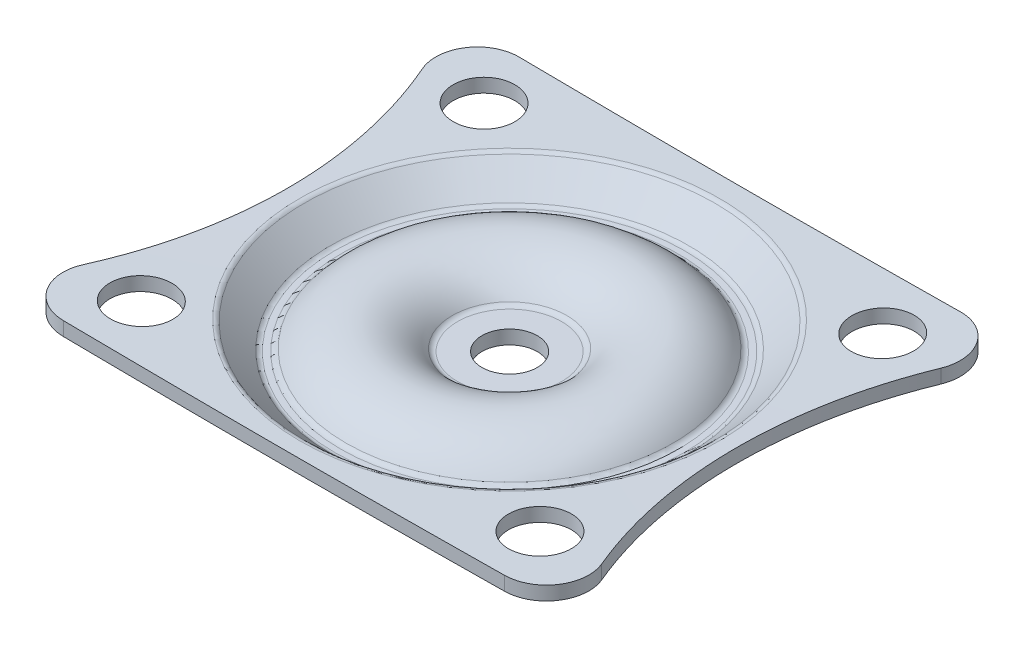
from build123d import *

# Parameters (mm, degrees)
CROQUIS2_W            = 83.65519823
CROQUIS2_H            = 71.804045148
CORTAR_EXTRUIR4_DEPTH = 10
CROQUIS2_6_R          = 2.25
CROQUIS2_6_R_2        = 2.25298443
CORTAR_EXTRUIR5_DEPTH = 10
CROQUIS3_R            = 2
CORTAR_EXTRUIR6_DEPTH = 10


with BuildPart() as part:
    # Croquis1 → Revolución1 (revolve)
    with BuildSketch(Plane.XY, mode=Mode.PRIVATE) as revoluci_n1_sk:
        with BuildLine():
            Line((3.763832281, 0), (0, 0))
            Line((0, 0), (0, -1))
            Line((0, -1), (3.763832281, -1))
            ThreePointArc((3.763832281, -1), (4.40491472, -0.856102248), (4.92299673, -0.452017741))
            ThreePointArc((4.92299673, -0.452017741), (7.994496433, 1), (11.065996136, -0.452017741))
            ThreePointArc((11.065996136, -0.452017741), (11.584078146, -0.856102248), (12.225160585, -1))
            Line((12.225160585, -1), (12.65047403, -1))
            ThreePointArc((12.65047403, -1), (13.198865955, -0.896161272), (13.67133212, -0.599021729))
            Line((13.67133212, -0.599021729), (15.258817463, 0.875559903))
            ThreePointArc((15.258817463, 0.875559903), (15.412659567, 0.973157537), (15.591255973, 1.00915774))
            Line((15.591255973, 1.00915774), (30.541484826, 1.243831091))
            Line((30.541484826, 1.243831091), (30.525789785, 2.243707916))
            Line((30.525789785, 2.243707916), (15.191853644, 2.003011522))
            ThreePointArc((15.191853644, 2.003011522), (15.013257238, 1.967011319), (14.859415134, 1.869413685))
            Line((14.859415134, 1.869413685), (12.99076006, 0.133659424))
            ThreePointArc((12.99076006, 0.133659424), (12.833271339, 0.034612909), (12.65047403, 0))
            Line((12.65047403, 0), (12.225160585, 0))
            ThreePointArc((12.225160585, 0), (12.011466439, 0.047965917), (11.838772435, 0.182660753))
            ThreePointArc((11.838772435, 0.182660753), (7.994496433, 2), (4.15022043, 0.182660753))
            ThreePointArc((4.15022043, 0.182660753), (3.977526427, 0.047965917), (3.763832281, 0))
        make_face()
    revolve(revoluci_n1_sk.sketch.rotate(Axis((0, -1, 0), (0, -1, 0)), 90), axis=Axis((0, -1, 0), (0, -1, 0)))

    # Croquis2 → Cortar-Extruir4 (cut)
    with BuildSketch(Plane(origin=(0, 0, 0), x_dir=(1, 0, 0), z_dir=(0, 1, 0))):
        with Locations((0, 0.174281663)):
            Rectangle(CROQUIS2_W, CROQUIS2_H)
        with BuildLine():
            ThreePointArc((-18.756401251, -12.093606936), (-18.496422252, -14.961624224), (-15.96021258, -16.325718337))
            Line((-15.96021258, -16.325718337), (15.96021258, -16.325718337))
            ThreePointArc((15.96021258, -16.325718337), (18.496422252, -14.961624224), (18.756401251, -12.093606936))
            ThreePointArc((18.756401251, -12.093606936), (16.25, 0.174281663), (18.756401251, 12.442170262))
            ThreePointArc((18.756401251, 12.442170262), (18.496422252, 15.31018755), (15.96021258, 16.674281663))
            Line((15.96021258, 16.674281663), (-15.96021258, 16.674281663))
            ThreePointArc((-15.96021258, 16.674281663), (-18.496422252, 15.31018755), (-18.756401251, 12.442170262))
            ThreePointArc((-18.756401251, 12.442170262), (-16.25, 0.174281663), (-18.756401251, -12.093606936))
        make_face(mode=Mode.SUBTRACT)
    extrude(amount=CORTAR_EXTRUIR4_DEPTH, mode=Mode.SUBTRACT)

    # Croquis2<6> → Cortar-Extruir5 (cut)
    with BuildSketch(Plane(origin=(0, 0, 0), x_dir=(1, 0, 0), z_dir=(0, 1, 0))):
        with Locations(Location((-14.422555001, 12.574281663, 0), (0, 0, 135.000563098))):
            Circle(CROQUIS2_6_R)
        with Locations(Location((-14.422555001, -12.225718337, 0), (0, 0, 135.022269614))):
            Circle(CROQUIS2_6_R_2)
        with Locations(Location((14.422555001, -12.225718337, 0), (0, 0, 134.996234956))):
            Circle(CROQUIS2_6_R_2)
        with Locations(Location((14.422555001, 12.574281663, 0), (0, 0, 134.975260841))):
            Circle(CROQUIS2_6_R)
    extrude(amount=CORTAR_EXTRUIR5_DEPTH, mode=Mode.SUBTRACT)

    # Croquis3 → Cortar-Extruir6 (cut)
    with BuildSketch(Plane(origin=(0, 0, 0), x_dir=(1, 0, 0), z_dir=(0, 1, 0))):
        with Locations(Location((0, 0, 0), (0, 0, 270))):
            Circle(CROQUIS3_R)
    extrude(amount=-CORTAR_EXTRUIR6_DEPTH, mode=Mode.SUBTRACT)


solid = part.part
